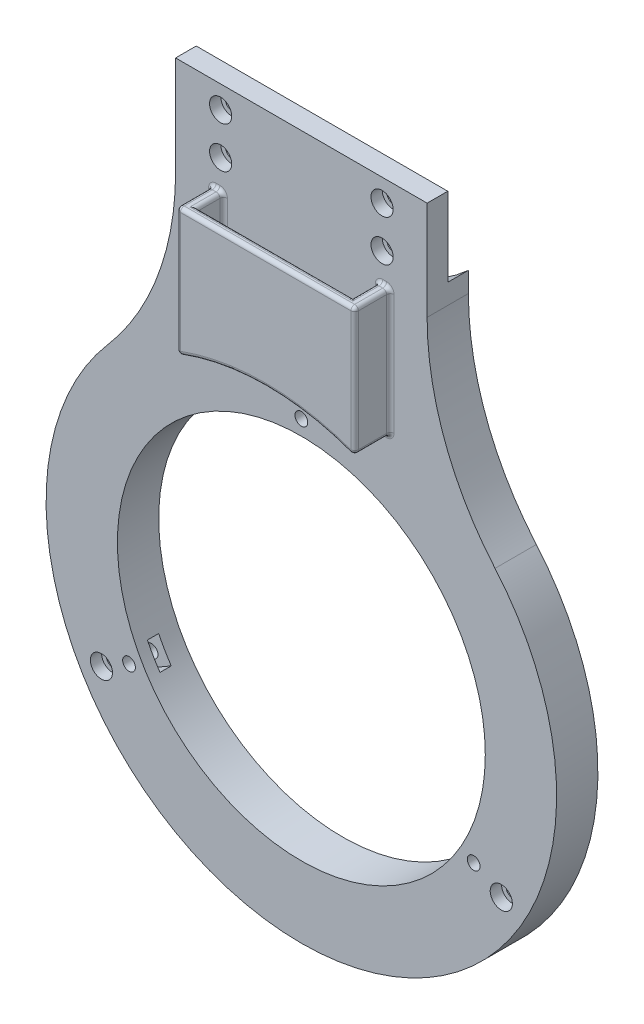
from build123d import *

# Parameters (mm, degrees)
BOSS_EXTRUDE1_DEPTH      = 5.5
BOSS_EXTRUDE1_DEPTH_BACK = 5.5
SKETCH1_R                = 68
SKETCH1_R_2              = 49
BOSS_EXTRUDE2_DEPTH      = 11
SKETCH3_R                = 1.7
CUT_EXTRUDE1_DEPTH       = 138.932048488
SKETCH4_R                = 2.95
CUT_EXTRUDE2_DEPTH       = 3
CUT_EXTRUDE3_START       = -5.5
SKETCH5_R                = 1.7
CUT_EXTRUDE3_DEPTH       = 5.5
SKETCH6_R                = 1.7
CUT_EXTRUDE4_DEPTH       = 138.932048488
SKETCH7_R                = 1.7
CUT_EXTRUDE5_DEPTH       = 138.932048488
CIRPATTERN1_COUNT        = 3
CUT_EXTRUDE6_DEPTH       = 3
CIRPATTERN2_COUNT        = 3
SKETCH10_R               = 2.95
CUT_EXTRUDE8_DEPTH       = 3
CIRPATTERN4_COUNT        = 3
BOSS_EXTRUDE4_DEPTH      = 9.5
SKETCH14_W               = 41.4
SKETCH14_H               = 7
CUT_EXTRUDE10_DEPTH      = 178.251234128
FILLET2_R                = 1


with BuildPart() as part:
    # Sketch1 → Boss-Extrude1 (new, two sides: drawn at the far end of the back side and taken through both)
    with BuildSketch(Plane.XY.offset(-BOSS_EXTRUDE1_DEPTH_BACK)):
        Circle(SKETCH1_R)
        Circle(SKETCH1_R_2, mode=Mode.SUBTRACT)
    extrude(amount=BOSS_EXTRUDE1_DEPTH + BOSS_EXTRUDE1_DEPTH_BACK)

    # Sketch2 → Boss-Extrude2 (add)
    with BuildSketch(Plane(origin=(0, 0, -5.5), x_dir=(-1, 0, 0), z_dir=(0, 0, -1))):
        with BuildLine():
            Line((-33.5, 119.5), (-33.5, 93.149074069))
            ThreePointArc((-33.5, 93.149074069), (-38.168927278, 67.100269686), (-51.594405594, 44.294664592))
            Line((-51.594405594, 44.294664592), (-20.951913723, 44.294664592))
            ThreePointArc((-20.951913723, 44.294664592), (0, 49), (20.951913723, 44.294664592))
            Line((20.951913723, 44.294664592), (51.594405594, 44.294664592))
            ThreePointArc((51.594405594, 44.294664592), (38.168927278, 67.100269686), (33.5, 93.149074069))
            Line((33.5, 93.149074069), (33.5, 119.5))
            Line((33.5, 119.5), (-33.5, 119.5))
        make_face()
    extrude(amount=-BOSS_EXTRUDE2_DEPTH)

    # Sketch3 → Cut-Extrude1 (cut, through all)
    with BuildSketch(Plane.XY.offset(5.5)):
        with Locations((-21.5, 113.5)):
            Circle(SKETCH3_R)
        with Locations((-21.5, 102.5)):
            Circle(SKETCH3_R)
        with Locations((21.5, 102.5)):
            Circle(SKETCH3_R)
        with Locations((21.5, 113.5)):
            Circle(SKETCH3_R)
    extrude(amount=-CUT_EXTRUDE1_DEPTH, mode=Mode.SUBTRACT)

    # Sketch4 → Cut-Extrude2 (cut)
    with BuildSketch(Plane.XY.offset(5.5)):
        with Locations((-21.5, 113.5)):
            Circle(SKETCH4_R)
        with Locations((-21.5, 102.5)):
            Circle(SKETCH4_R)
        with Locations((21.5, 102.5)):
            Circle(SKETCH4_R)
        with Locations((21.5, 113.5)):
            Circle(SKETCH4_R)
    extrude(amount=-CUT_EXTRUDE2_DEPTH, mode=Mode.SUBTRACT)

    # Sketch5 → Cut-Extrude3 (cut)
    with BuildSketch(Plane(origin=(0, 0, -5.5), x_dir=(-1, 0, 0), z_dir=(0, 0, -1)).offset(CUT_EXTRUDE3_START)):
        with BuildLine():
            Line((33.5, 119.5), (-33.5, 119.5))
            Line((-33.5, 119.5), (-33.5, 98.5))
            ThreePointArc((-33.5, 98.5), (0, 85.618054906), (33.5, 98.5))
            Line((33.5, 98.5), (33.5, 119.5))
        make_face()
        with Locations((-21.5, 102.5)):
            Circle(SKETCH5_R, mode=Mode.SUBTRACT)
        with Locations((-21.5, 113.5)):
            Circle(SKETCH5_R, mode=Mode.SUBTRACT)
        with Locations((21.5, 102.5)):
            Circle(SKETCH5_R, mode=Mode.SUBTRACT)
        with Locations((21.5, 113.5)):
            Circle(SKETCH5_R, mode=Mode.SUBTRACT)
    extrude(amount=CUT_EXTRUDE3_DEPTH, mode=Mode.SUBTRACT)

    # Sketch6 → Cut-Extrude4 (cut, through all)
    with BuildSketch(Plane(origin=(0, 0, -5.5), x_dir=(-1, 0, 0), z_dir=(0, 0, -1))):
        with Locations((0, 61.5)):
            Circle(SKETCH6_R)
        with Locations((53.260562333, -30.75)):
            Circle(SKETCH6_R)
        with Locations((-53.260562333, -30.75)):
            Circle(SKETCH6_R)
    extrude(amount=-CUT_EXTRUDE4_DEPTH, mode=Mode.SUBTRACT)

    # Sketch7 → Cut-Extrude5 (cut, through all)
    with BuildSketch(Plane(origin=(0, 0, -5.5), x_dir=(-1, 0, 0), z_dir=(0, 0, -1))):
        with Locations((0, 53)):
            Circle(SKETCH7_R)
    cut_extrude5 = extrude(amount=-CUT_EXTRUDE5_DEPTH, mode=Mode.SUBTRACT)

    # CirPattern1: Cut-Extrude5 ×3 about axis
    cirpattern1_axis = Axis((0, 0, -5.5), (0, 0, 1))
    for i in range(1, CIRPATTERN1_COUNT):
        add(cut_extrude5.rotate(cirpattern1_axis, i * 360 / CIRPATTERN1_COUNT), mode=Mode.SUBTRACT)

    # Sketch8 → Cut-Extrude6 (cut)
    with BuildSketch(Plane.XY.offset(2.5)):
        Polygon((1.675, 55.901185103), (-1.675, 55.901185103), (-3.35, 53), (-3.35, 47.346917497), (3.35, 47.346917497), (3.35, 53), align=None)
    cut_extrude6 = extrude(amount=-CUT_EXTRUDE6_DEPTH, mode=Mode.SUBTRACT)

    # CirPattern2: Cut-Extrude6 ×3 about axis
    cirpattern2_axis = Axis((0, 0, 5.5), (0, 0, 1))
    for i in range(1, CIRPATTERN2_COUNT):
        add(cut_extrude6.rotate(cirpattern2_axis, i * 360 / CIRPATTERN2_COUNT), mode=Mode.SUBTRACT)

    # Sketch10 → Cut-Extrude8 (cut)
    with BuildSketch(Plane.XY.offset(5.5)):
        with Locations((0, 61.5)):
            Circle(SKETCH10_R)
    cut_extrude8 = extrude(amount=-CUT_EXTRUDE8_DEPTH, mode=Mode.SUBTRACT)

    # CirPattern4: Cut-Extrude8 ×3 about axis
    cirpattern4_axis = Axis((0, 0, 5.5), (0, 0, 1))
    for i in range(1, CIRPATTERN4_COUNT):
        add(cut_extrude8.rotate(cirpattern4_axis, i * 360 / CIRPATTERN4_COUNT), mode=Mode.SUBTRACT)

    # Sketch13 → Boss-Extrude4 (add)
    with BuildSketch(Plane.XY.offset(5.5)):
        with BuildLine():
            Line((-23.7, 95), (-23.7, 60.525283973))
            ThreePointArc((-23.7, 60.525283973), (0, 65), (23.7, 60.525283973))
            Line((23.7, 60.525283973), (23.7, 95))
            Line((23.7, 95), (-23.7, 95))
        make_face()
    extrude(amount=BOSS_EXTRUDE4_DEPTH)

    # Sketch14 → Cut-Extrude10 (cut, through all)
    with BuildSketch(Plane(origin=(0, 95, 0), x_dir=(1, 0, 0), z_dir=(0, 1, 0))):
        with Locations((0, -9)):
            Rectangle(SKETCH14_W, SKETCH14_H)
    extrude(amount=-CUT_EXTRUDE10_DEPTH, mode=Mode.SUBTRACT)

    # Fillet2
    fillet2_edges = [part.edges().sort_by_distance(p)[0] for p in [
        (23.7, 77.762641986, 5.5),
        (-20.7, 78.307912945, 5.5),
        (22.206695396, 61.08897347, 5.5),
        (22.2, 95, 5.5),
        (-22.206695396, 61.08897347, 5.5),
        (-22.2, 95, 5.5),
        (20.7, 78.307912945, 5.5),
        (-23.7, 77.762641986, 5.5),
        (20.7, 61.615825889, 9),
        (-20.7, 61.615825889, 9),
        (0, 65, 12.5),
        (0, 95, 15),
        (23.7, 95, 10.25),
        (20.7, 95, 9),
        (0, 95, 12.5),
        (-20.7, 95, 9),
        (-23.7, 95, 10.25),
        (-23.7, 60.525283973, 10.25),
        (0, 65, 15),
        (23.7, 60.525283973, 10.25),
        (23.7, 77.762641986, 15),
        (-23.7, 77.762641986, 15),
    ]]
    fillet(fillet2_edges, radius=FILLET2_R)


solid = part.part
